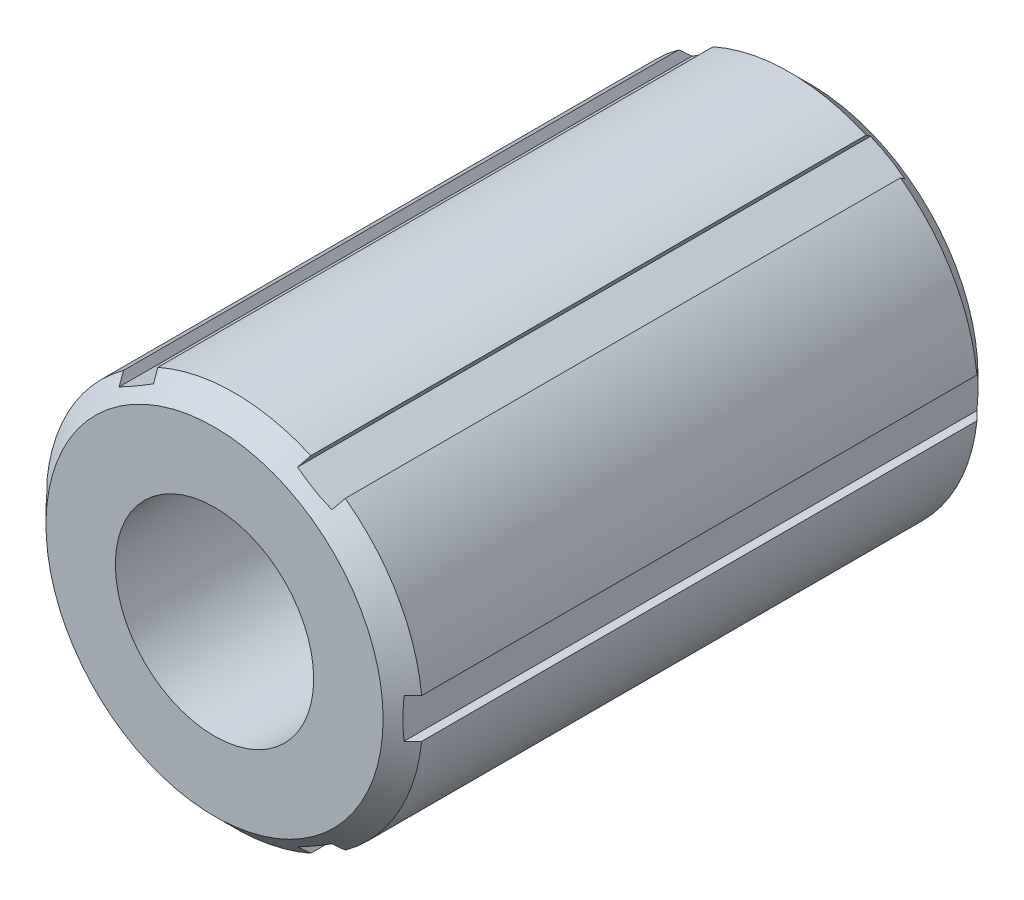
from build123d import *

# Parameters (mm, degrees)
SKETCH_1_R          = 9.5
SKETCH_1_R_2        = 5
EXTRUDE_1_DEPTH     = 30
CHAMFER_1_SIZE      = 1
SKETCH_2_W          = 1
SKETCH_2_H          = 2
CUT_EXTRUDE_1_DEPTH = 33.870959828


with BuildPart() as part:
    # 스케치1 → 보스-돌출1 (new body)
    with BuildSketch(Plane.XY):
        Circle(SKETCH_1_R)
        Circle(SKETCH_1_R_2, mode=Mode.SUBTRACT)
    extrude(amount=EXTRUDE_1_DEPTH)

    # 모따기1
    chamfer_1_edges = [part.edges().sort_by_distance(p)[0] for p in [
        (-9.5, 0, 0),
        (-9.5, 0, 30),
    ]]
    chamfer(chamfer_1_edges, length=CHAMFER_1_SIZE)

    # 스케치2 → 컷-돌출1 (cut, through all)
    with BuildSketch(Plane.XY):
        Polygon((-3.633974596, 8.294228634), (-5.366025404, 7.294228634), (-5.866025404, 8.160254038), (-4.133974596, 9.160254038), align=None)
        with Locations((-9.5, 0)):
            Rectangle(SKETCH_2_W, SKETCH_2_H)
        Polygon((5.366025404, 7.294228634), (3.633974596, 8.294228634), (4.133974596, 9.160254038), (5.866025404, 8.160254038), align=None)
        with Locations((9.5, 0)):
            Rectangle(SKETCH_2_W, SKETCH_2_H)
        Polygon((3.633974596, -8.294228634), (5.366025404, -7.294228634), (5.866025404, -8.160254038), (4.133974596, -9.160254038), align=None)
        Polygon((-5.366025404, -7.294228634), (-3.633974596, -8.294228634), (-4.133974596, -9.160254038), (-5.866025404, -8.160254038), align=None)
    extrude(amount=CUT_EXTRUDE_1_DEPTH, mode=Mode.SUBTRACT)


solid = part.part
